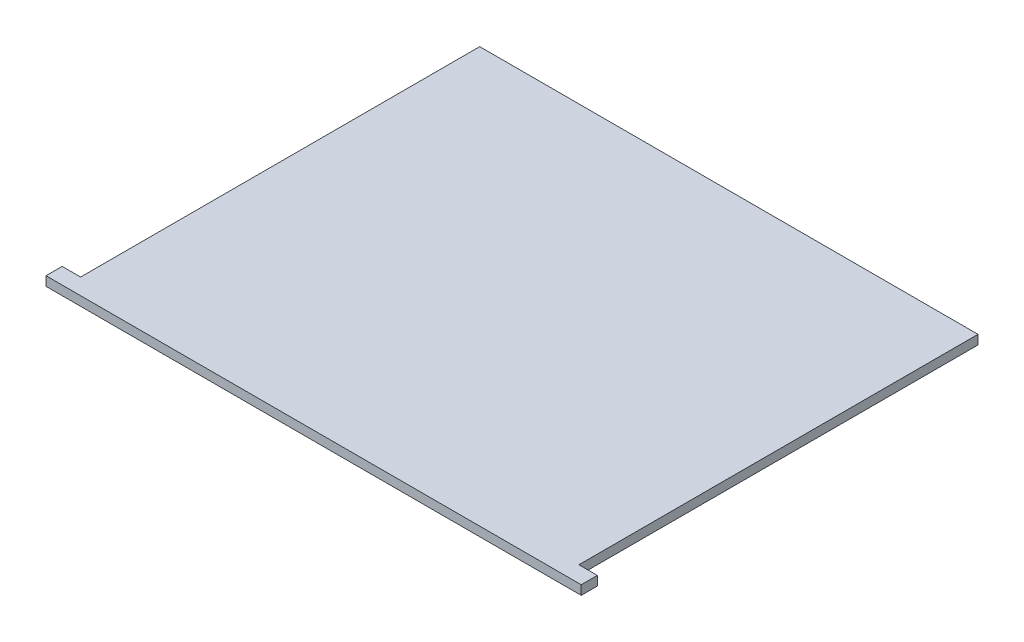
from build123d import *

# Parameters (mm, degrees)
BOSS_EXTRUDE1_DEPTH = 1


with BuildPart() as part:
    # Sketch1 → Boss-Extrude1 (new body)
    with BuildSketch(Plane(origin=(0, 0, 0), x_dir=(1, 0, 0), z_dir=(0, 1, 0))):
        Polygon((-27, -22.5), (27, -22.5), (29, -22.5), (29, -20.75), (27, -20.75), (27, 22.5), (-27, 22.5), (-27, -20.75), (-29, -20.75), (-29, -22.5), align=None)
    extrude(amount=BOSS_EXTRUDE1_DEPTH)


solid = part.part
